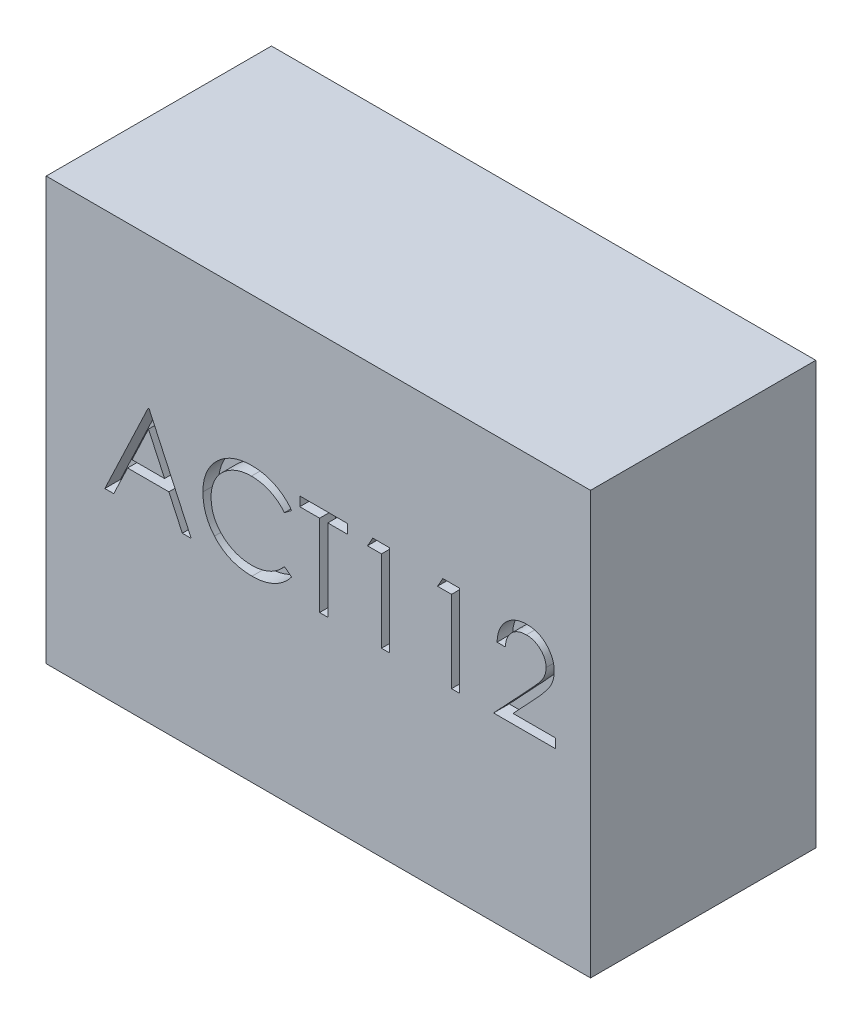
from build123d import *

# Parameters (mm, degrees)
SKETCH1_W           = 17.4
SKETCH1_H           = 7.2
BOSS_EXTRUDE1_DEPTH = 13.5
CUT_EXTRUDE1_DEPTH  = 0.5
CUT_EXTRUDE2_DEPTH  = 0.5


with BuildPart() as part:
    # Sketch1 → Boss-Extrude1 (new body)
    with BuildSketch(Plane(origin=(0, 0, 0), x_dir=(1, 0, 0), z_dir=(0, 1, 0))):
        Rectangle(SKETCH1_W, SKETCH1_H)
    extrude(amount=BOSS_EXTRUDE1_DEPTH)

    # Sketch3 → Cut-Extrude1 (cut)
    # profile 1 of 6: a face of its own
    with BuildSketch(Plane(origin=(0, 0, -3.6), x_dir=(-1, 0, 0), z_dir=(0, 0, -1))):
        Polygon((-6.182108672, 8.680727113), (-4.838839441, 5.770310446), (-5.122768311, 5.770310446), (-5.553034236, 6.703136301), (-6.872399805, 6.703136301), (-7.314909069, 5.770310446), (-7.600003971, 5.770310446), (-6.219421706, 8.680727113), align=None)
        Polygon((-6.20368027, 8.11345239), (-6.730726878, 7.001640575), (-5.69062605, 7.001640575), align=None, mode=Mode.SUBTRACT)
    # profile 2 of 6: a face of its own
    with BuildSketch(Plane(origin=(0, 0, -3.6), x_dir=(-1, 0, 0), z_dir=(0, 0, -1))):
        with BuildLine():
            Line((-1.629918501, 8.146684311), (-1.858460836, 7.971779464))
            add(Edge.make_bspline(
                [(-1.858460836, 7.971779464), (-1.874764065, 7.99120938), (-1.907150722, 8.029807256), (-1.959254833, 8.084007151), (-2.013556258, 8.134785824), (-2.070034242, 8.182385172), (-2.129705367, 8.225140662), (-2.191124138, 8.265280382), (-2.255317989, 8.301259567), (-2.34408714, 8.344885038), (-2.460210975, 8.390409073), (-2.606392755, 8.428579795), (-2.758990972, 8.452878595), (-2.863098738, 8.455510311), (-2.916052148, 8.456848908)],
                knots=[0, 0, 0, 0, 0.757959112, 1.505699292, 2.245454638, 2.979532153, 3.711538275, 4.438200793, 5.171680507, 5.909471876, 7.393775596, 8.890124382, 10.418191784, 12, 12, 12, 12], degree=3))
            add(Edge.make_bspline(
                [(-2.916052148, 8.456848908), (-2.945225582, 8.456512994), (-3.003301693, 8.455844283), (-3.089490335, 8.447022291), (-3.17406958, 8.434622909), (-3.256984413, 8.41622465), (-3.338129289, 8.392964085), (-3.418034698, 8.365169261), (-3.49554375, 8.330780743), (-3.571728678, 8.292772148), (-3.644721272, 8.249841469), (-3.713785499, 8.203014236), (-3.77866947, 8.152814457), (-3.839424511, 8.099053984), (-3.896112732, 8.041974925), (-3.948323371, 7.980968981), (-3.995875763, 7.916231192), (-4.03971248, 7.848615221), (-4.078972116, 7.778318022), (-4.111843093, 7.705079407), (-4.140951519, 7.630153554), (-4.163984758, 7.552693928), (-4.182216038, 7.473245569), (-4.19479541, 7.391595253), (-4.203517073, 7.307913556), (-4.204182459, 7.251194265), (-4.20451786, 7.222603699)],
                knots=[0, 0, 0, 0, 1.054917814, 2.100044995, 3.131103042, 4.146048494, 5.169673617, 6.183595914, 7.203665975, 8.234915748, 9.262203917, 10.264457458, 11.251630812, 12.227803204, 13.197192746, 14.159520551, 15.12972552, 16.100847026, 17.073214652, 18.039054194, 19.002613845, 19.979014051, 20.95965708, 21.949030935, 22.966165397, 24, 24, 24, 24], degree=3))
            add(Edge.make_bspline(
                [(-4.20451786, 7.222603699), (-4.203468598, 7.179586643), (-4.20140851, 7.09512836), (-4.18307427, 6.971418513), (-4.155213191, 6.852905786), (-4.113456548, 6.740331), (-4.061967908, 6.632306014), (-3.996907114, 6.530658587), (-3.921555148, 6.43385267), (-3.834846003, 6.344176123), (-3.739712119, 6.26225727), (-3.637641386, 6.19012003), (-3.528888023, 6.129986762), (-3.414652813, 6.079947597), (-3.294056693, 6.041482925), (-3.167316527, 6.014404306), (-3.034707969, 5.996740421), (-2.944094724, 5.995049313), (-2.897978647, 5.994188652)],
                knots=[0, 0, 0, 0, 1.029171465, 2.020641659, 2.987623507, 3.938342917, 4.889210282, 5.84687017, 6.821220943, 7.821438502, 8.827599549, 9.822697543, 10.807740252, 11.797342354, 12.80366471, 13.83203677, 14.896651826, 16, 16, 16, 16], degree=3))
            add(Edge.make_bspline(
                [(-2.897978647, 5.994188652), (-2.847168852, 5.995592952), (-2.747163019, 5.998356952), (-2.600504607, 6.021772709), (-2.460109628, 6.059739442), (-2.325970531, 6.112873607), (-2.198465471, 6.181946349), (-2.077394915, 6.265681429), (-1.962656668, 6.364875359), (-1.893662096, 6.440615317), (-1.858460836, 6.479258096)],
                knots=[0, 0, 0, 0, 1.028121516, 2.023589091, 2.998037872, 3.967518031, 4.937445131, 5.927275754, 6.942489185, 8, 8, 8, 8], degree=3))
            Line((-1.858460836, 6.479258096), (-1.629918501, 6.306102297))
            add(Edge.make_bspline(
                [(-1.629918501, 6.306102297), (-1.648310763, 6.282371215), (-1.685007188, 6.235022722), (-1.744427932, 6.168272973), (-1.807024589, 6.105487772), (-1.873262105, 6.047173316), (-1.942378507, 5.992162727), (-2.015614829, 5.942018883), (-2.092008304, 5.89604188), (-2.171300094, 5.853943181), (-2.253405952, 5.816592351), (-2.338227497, 5.784616212), (-2.425399113, 5.757071289), (-2.514924784, 5.734410006), (-2.606990208, 5.716722087), (-2.701263156, 5.70489775), (-2.797947093, 5.696796885), (-2.86317487, 5.69605854), (-2.896229599, 5.695684378)],
                knots=[0, 0, 0, 0, 0.986787822, 1.968848986, 2.935600012, 3.899624008, 4.868462664, 5.837806735, 6.815139263, 7.798259679, 8.787526145, 9.778297419, 10.776456485, 11.791383307, 12.812564526, 13.85620153, 14.913611965, 16, 16, 16, 16], degree=3))
            add(Edge.make_bspline(
                [(-2.896229599, 5.695684378), (-2.927532101, 5.695902237), (-2.989428922, 5.696333027), (-3.080814967, 5.703311514), (-3.169781898, 5.712832515), (-3.256075441, 5.727168505), (-3.340166505, 5.744085793), (-3.421292777, 5.766763141), (-3.500252556, 5.792166228), (-3.57672861, 5.822022934), (-3.650785992, 5.85571407), (-3.72218584, 5.893791931), (-3.790895316, 5.935936315), (-3.857589943, 5.981218249), (-3.921284481, 6.031092232), (-3.982530894, 6.084865618), (-4.04167262, 6.142357166), (-4.078262948, 6.183813851), (-4.096659871, 6.204657485)],
                knots=[0, 0, 0, 0, 1.114604814, 2.203992996, 3.262667896, 4.300477797, 5.318619304, 6.316056647, 7.298880507, 8.271930387, 9.238335007, 10.195173496, 11.151986948, 12.108099108, 13.064862484, 14.031167946, 15.010108607, 16, 16, 16, 16], degree=3))
            add(Edge.make_bspline(
                [(-4.096659871, 6.204657485), (-4.126126296, 6.240864057), (-4.184703401, 6.312840084), (-4.259647199, 6.429494557), (-4.323799065, 6.551289848), (-4.375667613, 6.678865824), (-4.416216148, 6.811936217), (-4.44430682, 6.950568106), (-4.462560624, 7.09463202), (-4.464648049, 7.192618921), (-4.465709099, 7.242426248)],
                knots=[0, 0, 0, 0, 0.994628077, 1.977248131, 2.950237994, 3.925870899, 4.908910175, 5.911660606, 6.938484602, 8, 8, 8, 8], degree=3))
            add(Edge.make_bspline(
                [(-4.465709099, 7.242426248), (-4.464415882, 7.294776706), (-4.461871557, 7.397772963), (-4.440254815, 7.548926661), (-4.405480495, 7.693741842), (-4.356089154, 7.83194817), (-4.293469168, 7.964272576), (-4.216113109, 8.08970422), (-4.124919658, 8.209045274), (-4.020604032, 8.320484921), (-3.906210242, 8.422382228), (-3.783707633, 8.51202822), (-3.653335978, 8.586632607), (-3.51653155, 8.648995487), (-3.372269945, 8.696929603), (-3.220858953, 8.730485199), (-3.062583081, 8.751371278), (-2.95459629, 8.754011614), (-2.899727696, 8.755353182)],
                knots=[0, 0, 0, 0, 1.032925535, 2.032216505, 3.007276963, 3.968222605, 4.92396291, 5.891752235, 6.871517503, 7.883894988, 8.900124299, 9.891468569, 10.874487609, 11.85992873, 12.854644235, 13.869047385, 14.917252991, 16, 16, 16, 16], degree=3))
            add(Edge.make_bspline(
                [(-2.899727696, 8.755353182), (-2.866287447, 8.754952261), (-2.800095843, 8.754158678), (-2.702178906, 8.746420178), (-2.606848352, 8.733519876), (-2.514038505, 8.715960858), (-2.423297854, 8.694168222), (-2.335319915, 8.665778938), (-2.249588448, 8.633318204), (-2.166644144, 8.595933098), (-2.086884965, 8.5539676), (-2.010335752, 8.50788687), (-1.937604557, 8.457748036), (-1.868179604, 8.403977527), (-1.803222255, 8.345437773), (-1.740888216, 8.283738938), (-1.683294331, 8.217103848), (-1.647743014, 8.170200459), (-1.629918501, 8.146684311)],
                knots=[0, 0, 0, 0, 1.096760587, 2.17092713, 3.219439832, 4.250915756, 5.268269357, 6.278326846, 7.281116186, 8.274029601, 9.260640565, 10.235837813, 11.203064059, 12.156899882, 13.114053108, 14.069676657, 15.032185724, 16, 16, 16, 16], degree=3))
        make_face()
    # profile 3 of 6: a face of its own
    with BuildSketch(Plane(origin=(0, 0, -3.6), x_dir=(-1, 0, 0), z_dir=(0, 0, -1))):
        Polygon((-1.368727262, 8.38222284), (-1.368727262, 8.680727113), (0.16110714, 8.680727113), (0.16110714, 8.38222284), (-0.473214441, 8.38222284), (-0.473214441, 5.770310446), (-0.734405681, 5.770310446), (-0.734405681, 8.38222284), align=None)
    # profile 4 of 6: a face of its own
    with BuildSketch(Plane(origin=(0, 0, -3.6), x_dir=(-1, 0, 0), z_dir=(0, 0, -1))):
        Polygon((0.966252456, 8.680727113), (1.504376371, 8.680727113), (1.504376371, 5.770310446), (1.243185131, 5.770310446), (1.243185131, 8.38222284), (0.795428721, 8.38222284), align=None)
    # profile 5 of 6: a face of its own
    with BuildSketch(Plane(origin=(0, 0, -3.6), x_dir=(-1, 0, 0), z_dir=(0, 0, -1))):
        Polygon((3.205034507, 8.680727113), (3.743158422, 8.680727113), (3.743158422, 5.770310446), (3.481967183, 5.770310446), (3.481967183, 8.38222284), (3.034210772, 8.38222284), align=None)
    # profile 6 of 6: a face of its own
    with BuildSketch(Plane(origin=(0, 0, -3.6), x_dir=(-1, 0, 0), z_dir=(0, 0, -1))):
        with BuildLine():
            Line((5.198366755, 7.785214293), (4.937175516, 7.785214293))
            add(Edge.make_bspline(
                [(4.937175516, 7.785214293), (4.938877821, 7.81986562), (4.942221103, 7.887919905), (4.957877722, 7.987143415), (4.980280345, 8.081985412), (5.011955203, 8.171684382), (5.051292625, 8.257033438), (5.098466344, 8.33769357), (5.154341231, 8.413357076), (5.217710759, 8.483322531), (5.286536824, 8.547507672), (5.360798965, 8.60293468), (5.438835574, 8.649765506), (5.520409896, 8.6889158), (5.606442281, 8.718302565), (5.696152015, 8.740107107), (5.789933237, 8.75322589), (5.853829374, 8.754636016), (5.886325823, 8.755353182)],
                knots=[0, 0, 0, 0, 1.10065271, 2.161652631, 3.183658789, 4.190468796, 5.17591951, 6.163126047, 7.15150782, 8.156236427, 9.156009102, 10.134482811, 11.092018607, 12.041330605, 13.001268258, 13.972401359, 14.968799086, 16, 16, 16, 16], degree=3))
            add(Edge.make_bspline(
                [(5.886325823, 8.755353182), (5.918239019, 8.754606072), (5.98094731, 8.753138029), (6.072469116, 8.740530911), (6.159596425, 8.720785321), (6.242158931, 8.693081966), (6.319497903, 8.655841582), (6.392194327, 8.611106367), (6.461113668, 8.559367614), (6.523152762, 8.49845358), (6.580120492, 8.433424573), (6.629266831, 8.364000406), (6.671354087, 8.292296649), (6.706435152, 8.217766531), (6.73225981, 8.139708301), (6.751866213, 8.059258395), (6.762948592, 7.975584073), (6.764649459, 7.918950229), (6.765514191, 7.890157201)],
                knots=[0, 0, 0, 0, 1.111607364, 2.184268762, 3.212621178, 4.221274766, 5.211760367, 6.196651075, 7.1921475, 8.207485113, 9.220403448, 10.201281604, 11.166441695, 12.114753415, 13.065576456, 14.026450734, 14.996634279, 16, 16, 16, 16], degree=3))
            add(Edge.make_bspline(
                [(6.765514191, 7.890157201), (6.764106162, 7.849621056), (6.761314814, 7.769260116), (6.737437442, 7.651167995), (6.700145433, 7.536752515), (6.655244059, 7.444669175), (6.609947628, 7.370467276), (6.569129028, 7.309374549), (6.521344301, 7.243594585), (6.465897955, 7.173347656), (6.403936954, 7.098083529), (6.334900072, 7.017847669), (6.258295009, 6.933469061), (6.204528387, 6.875838153), (6.17666787, 6.84597526)],
                knots=[0, 0, 0, 0, 1.184426356, 2.348067706, 3.509069118, 4.696110526, 5.333549288, 6.050745305, 6.844228056, 7.710549037, 8.667450064, 9.695053472, 10.805634456, 12, 12, 12, 12], degree=3))
            Line((6.17666787, 6.84597526), (5.448480688, 6.06881472))
            Line((5.448480688, 6.06881472), (6.802827225, 6.06881472))
            Line((6.802827225, 6.06881472), (6.802827225, 5.770310446))
            Line((6.802827225, 5.770310446), (4.825236413, 5.770310446))
            Line((4.825236413, 5.770310446), (5.953955698, 6.974821831))
            add(Edge.make_bspline(
                [(5.953955698, 6.974821831), (5.981436589, 7.003508816), (6.034221758, 7.058610643), (6.108880246, 7.139057021), (6.175935404, 7.213688038), (6.235821296, 7.282362685), (6.2872388, 7.346085483), (6.332867674, 7.402792627), (6.369427156, 7.45497594), (6.40910478, 7.515463225), (6.447533906, 7.589314896), (6.480556621, 7.679565826), (6.500692421, 7.772472357), (6.50310793, 7.835255896), (6.504322952, 7.866836555)],
                knots=[0, 0, 0, 0, 1.329631726, 2.553950428, 3.673215718, 4.687767853, 5.603093632, 6.413772471, 7.123043292, 7.734684054, 8.834405432, 9.900288307, 10.943827018, 12, 12, 12, 12], degree=3))
            add(Edge.make_bspline(
                [(6.504322952, 7.866836555), (6.503794302, 7.886695075), (6.502752434, 7.925832404), (6.493557432, 7.983213979), (6.479661851, 8.038565791), (6.459750228, 8.092058102), (6.433467719, 8.143153087), (6.401475271, 8.191912944), (6.36456282, 8.239052518), (6.321861794, 8.283252017), (6.274952929, 8.323732757), (6.225397473, 8.359592488), (6.172968309, 8.389560725), (6.117886493, 8.414127549), (6.060305588, 8.433398982), (6.000114225, 8.446752456), (5.937478719, 8.455136521), (5.894709318, 8.456270895), (5.872916451, 8.456848908)],
                knots=[0, 0, 0, 0, 0.991446411, 1.95395049, 2.89581595, 3.838931463, 4.798493298, 5.75982156, 6.748411868, 7.785213223, 8.824556874, 9.840280684, 10.836137867, 11.835679398, 12.848801643, 13.863922112, 14.911575587, 16, 16, 16, 16], degree=3))
            add(Edge.make_bspline(
                [(5.872916451, 8.456848908), (5.850156301, 8.456254325), (5.805459122, 8.455086661), (5.739834189, 8.446918648), (5.677230479, 8.432827375), (5.617490516, 8.413554867), (5.560513218, 8.38905868), (5.506575676, 8.358547748), (5.455798976, 8.322139688), (5.408087665, 8.280861202), (5.364128749, 8.234903559), (5.32550596, 8.183671941), (5.291758419, 8.128101763), (5.262313956, 8.068342967), (5.23840223, 8.003853306), (5.220130509, 7.934861709), (5.205672518, 7.861667739), (5.200842457, 7.811122046), (5.198366755, 7.785214293)],
                knots=[0, 0, 0, 0, 1.031018746, 2.02475058, 2.990194455, 3.934040569, 4.864654155, 5.795059489, 6.735614925, 7.690564532, 8.649604399, 9.611025574, 10.590972636, 11.591080095, 12.624614302, 13.701020113, 14.821632451, 16, 16, 16, 16], degree=3))
        make_face()
    extrude(amount=-CUT_EXTRUDE1_DEPTH, mode=Mode.SUBTRACT)

    # Sketch2 → Cut-Extrude2 (cut)
    # profile 1 of 6: a face of its own
    with BuildSketch(Plane.XY.offset(3.6)):
        Polygon((-5.407986461, 8.697285282), (-4.06471723, 5.786868616), (-4.3486461, 5.786868616), (-4.778912025, 6.71969447), (-6.098277594, 6.71969447), (-6.540786858, 5.786868616), (-6.82588176, 5.786868616), (-5.445299495, 8.697285282), align=None)
        Polygon((-5.429558059, 8.130010559), (-5.956604667, 7.018198744), (-4.916503839, 7.018198744), align=None, mode=Mode.SUBTRACT)
    # profile 2 of 6: a face of its own
    with BuildSketch(Plane.XY.offset(3.6)):
        with BuildLine():
            Line((-0.85579629, 8.16324248), (-1.084338624, 7.988337633))
            add(Edge.make_bspline(
                [(-1.084338624, 7.988337633), (-1.100641854, 8.007767549), (-1.133028511, 8.046365425), (-1.185132622, 8.10056532), (-1.239434047, 8.151343993), (-1.295912031, 8.198943341), (-1.355583156, 8.241698831), (-1.417001927, 8.281838551), (-1.481195778, 8.317817736), (-1.569964929, 8.361443207), (-1.686088764, 8.406967242), (-1.832270544, 8.445137964), (-1.984868761, 8.469436764), (-2.088976527, 8.47206848), (-2.141929937, 8.473407077)],
                knots=[0, 0, 0, 0, 0.757959112, 1.505699292, 2.245454638, 2.979532153, 3.711538275, 4.438200793, 5.171680507, 5.909471876, 7.393775596, 8.890124382, 10.418191784, 12, 12, 12, 12], degree=3))
            add(Edge.make_bspline(
                [(-2.141929937, 8.473407077), (-2.171103371, 8.473071163), (-2.229179482, 8.472402452), (-2.315368124, 8.46358046), (-2.399947369, 8.451181078), (-2.482862202, 8.432782819), (-2.564007078, 8.409522254), (-2.643912487, 8.38172743), (-2.721421539, 8.347338912), (-2.797606467, 8.309330317), (-2.870599061, 8.266399638), (-2.939663288, 8.219572405), (-3.004547259, 8.169372626), (-3.0653023, 8.115612153), (-3.121990521, 8.058533094), (-3.17420116, 7.99752715), (-3.221753552, 7.932789361), (-3.265590269, 7.86517339), (-3.304849905, 7.794876191), (-3.337720882, 7.721637576), (-3.366829308, 7.646711724), (-3.389862547, 7.569252098), (-3.408093827, 7.489803738), (-3.420673199, 7.408153422), (-3.429394862, 7.324471725), (-3.430060247, 7.267752434), (-3.430395649, 7.239161868)],
                knots=[0, 0, 0, 0, 1.054917814, 2.100044995, 3.131103042, 4.146048494, 5.169673617, 6.183595914, 7.203665975, 8.234915748, 9.262203917, 10.264457458, 11.251630812, 12.227803204, 13.197192746, 14.159520551, 15.12972552, 16.100847026, 17.073214652, 18.039054194, 19.002613845, 19.979014051, 20.95965708, 21.949030935, 22.966165397, 24, 24, 24, 24], degree=3))
            add(Edge.make_bspline(
                [(-3.430395649, 7.239161868), (-3.429346386, 7.196144812), (-3.427286299, 7.111686529), (-3.408952059, 6.987976682), (-3.38109098, 6.869463955), (-3.339334336, 6.756889169), (-3.287845697, 6.648864184), (-3.222784903, 6.547216756), (-3.147432937, 6.450410839), (-3.060723792, 6.360734293), (-2.965589908, 6.278815439), (-2.863519175, 6.206678199), (-2.754765811, 6.146544931), (-2.640530602, 6.096505766), (-2.519934482, 6.058041094), (-2.393194316, 6.030962475), (-2.260585758, 6.01329859), (-2.169972513, 6.011607482), (-2.123856436, 6.010746821)],
                knots=[0, 0, 0, 0, 1.029171465, 2.020641659, 2.987623507, 3.938342917, 4.889210282, 5.84687017, 6.821220943, 7.821438502, 8.827599549, 9.822697543, 10.807740252, 11.797342354, 12.80366471, 13.83203677, 14.896651826, 16, 16, 16, 16], degree=3))
            add(Edge.make_bspline(
                [(-2.123856436, 6.010746821), (-2.073046641, 6.012151121), (-1.973040808, 6.014915121), (-1.826382396, 6.038330878), (-1.685987417, 6.076297611), (-1.55184832, 6.129431776), (-1.42434326, 6.198504518), (-1.303272704, 6.282239598), (-1.188534457, 6.381433528), (-1.119539885, 6.457173486), (-1.084338624, 6.495816265)],
                knots=[0, 0, 0, 0, 1.028121516, 2.023589091, 2.998037872, 3.967518031, 4.937445131, 5.927275754, 6.942489185, 8, 8, 8, 8], degree=3))
            Line((-1.084338624, 6.495816265), (-0.85579629, 6.322660466))
            add(Edge.make_bspline(
                [(-0.85579629, 6.322660466), (-0.874188552, 6.298929384), (-0.910884977, 6.251580891), (-0.970305721, 6.184831142), (-1.032902378, 6.122045941), (-1.099139894, 6.063731485), (-1.168256296, 6.008720896), (-1.241492618, 5.958577052), (-1.317886093, 5.912600049), (-1.397177883, 5.87050135), (-1.479283741, 5.833150521), (-1.564105286, 5.801174381), (-1.651276902, 5.773629458), (-1.740802573, 5.750968175), (-1.832867997, 5.733280256), (-1.927140944, 5.721455919), (-2.023824882, 5.713355054), (-2.089052659, 5.712616709), (-2.122107388, 5.712242547)],
                knots=[0, 0, 0, 0, 0.986787822, 1.968848986, 2.935600012, 3.899624008, 4.868462664, 5.837806735, 6.815139263, 7.798259679, 8.787526145, 9.778297419, 10.776456485, 11.791383307, 12.812564526, 13.85620153, 14.913611965, 16, 16, 16, 16], degree=3))
            add(Edge.make_bspline(
                [(-2.122107388, 5.712242547), (-2.15340989, 5.712460406), (-2.21530671, 5.712891196), (-2.306692756, 5.719869683), (-2.395659687, 5.729390685), (-2.48195323, 5.743726674), (-2.566044294, 5.760643962), (-2.647170565, 5.78332131), (-2.726130345, 5.808724397), (-2.802606399, 5.838581103), (-2.876663781, 5.872272239), (-2.948063628, 5.9103501), (-3.016773105, 5.952494484), (-3.083467731, 5.997776419), (-3.14716227, 6.047650401), (-3.208408683, 6.101423787), (-3.267550409, 6.158915335), (-3.304140737, 6.20037202), (-3.32253766, 6.221215654)],
                knots=[0, 0, 0, 0, 1.114604814, 2.203992996, 3.262667896, 4.300477797, 5.318619304, 6.316056647, 7.298880507, 8.271930387, 9.238335007, 10.195173496, 11.151986948, 12.108099108, 13.064862484, 14.031167946, 15.010108607, 16, 16, 16, 16], degree=3))
            add(Edge.make_bspline(
                [(-3.32253766, 6.221215654), (-3.352004085, 6.257422226), (-3.41058119, 6.329398253), (-3.485524988, 6.446052726), (-3.549676853, 6.567848017), (-3.601545402, 6.695423993), (-3.642093937, 6.828494386), (-3.670184609, 6.967126275), (-3.688438413, 7.111190189), (-3.690525838, 7.20917709), (-3.691586888, 7.258984417)],
                knots=[0, 0, 0, 0, 0.994628077, 1.977248131, 2.950237994, 3.925870899, 4.908910175, 5.911660606, 6.938484602, 8, 8, 8, 8], degree=3))
            add(Edge.make_bspline(
                [(-3.691586888, 7.258984417), (-3.690293671, 7.311334875), (-3.687749346, 7.414331132), (-3.666132604, 7.56548483), (-3.631358284, 7.710300011), (-3.581966943, 7.848506339), (-3.519346957, 7.980830745), (-3.441990898, 8.10626239), (-3.350797447, 8.225603443), (-3.246481821, 8.33704309), (-3.13208803, 8.438940397), (-3.009585422, 8.528586389), (-2.879213767, 8.603190776), (-2.742409339, 8.665553656), (-2.598147734, 8.713487772), (-2.446736741, 8.747043368), (-2.28846087, 8.767929447), (-2.180474079, 8.770569783), (-2.125605485, 8.771911351)],
                knots=[0, 0, 0, 0, 1.032925535, 2.032216505, 3.007276963, 3.968222605, 4.92396291, 5.891752235, 6.871517503, 7.883894988, 8.900124299, 9.891468569, 10.874487609, 11.85992873, 12.854644235, 13.869047385, 14.917252991, 16, 16, 16, 16], degree=3))
            add(Edge.make_bspline(
                [(-2.125605485, 8.771911351), (-2.092165236, 8.77151043), (-2.025973632, 8.770716847), (-1.928056695, 8.762978347), (-1.832726141, 8.750078045), (-1.739916294, 8.732519027), (-1.649175643, 8.710726391), (-1.561197704, 8.682337107), (-1.475466237, 8.649876373), (-1.392521933, 8.612491267), (-1.312762754, 8.570525769), (-1.236213541, 8.524445039), (-1.163482346, 8.474306206), (-1.094057393, 8.420535696), (-1.029100044, 8.361995942), (-0.966766005, 8.300297107), (-0.90917212, 8.233662017), (-0.873620803, 8.186758628), (-0.85579629, 8.16324248)],
                knots=[0, 0, 0, 0, 1.096760587, 2.17092713, 3.219439832, 4.250915756, 5.268269357, 6.278326846, 7.281116186, 8.274029601, 9.260640565, 10.235837813, 11.203064059, 12.156899882, 13.114053108, 14.069676657, 15.032185724, 16, 16, 16, 16], degree=3))
        make_face()
    # profile 3 of 6: a face of its own
    with BuildSketch(Plane.XY.offset(3.6)):
        Polygon((-0.594605051, 8.398781009), (-0.594605051, 8.697285282), (0.935229351, 8.697285282), (0.935229351, 8.398781009), (0.30090777, 8.398781009), (0.30090777, 5.786868616), (0.03971653, 5.786868616), (0.03971653, 8.398781009), align=None)
    # profile 4 of 6: a face of its own
    with BuildSketch(Plane.XY.offset(3.6)):
        Polygon((1.740374667, 8.697285282), (2.278498582, 8.697285282), (2.278498582, 5.786868616), (2.017307342, 5.786868616), (2.017307342, 8.398781009), (1.569550932, 8.398781009), align=None)
    # profile 5 of 6: a face of its own
    with BuildSketch(Plane.XY.offset(3.6)):
        Polygon((3.979156718, 8.697285282), (4.517280633, 8.697285282), (4.517280633, 5.786868616), (4.256089394, 5.786868616), (4.256089394, 8.398781009), (3.808332983, 8.398781009), align=None)
    # profile 6 of 6: a face of its own
    with BuildSketch(Plane.XY.offset(3.6)):
        with BuildLine():
            Line((5.972488966, 7.801772462), (5.711297727, 7.801772462))
            add(Edge.make_bspline(
                [(5.711297727, 7.801772462), (5.713000032, 7.836423789), (5.716343314, 7.904478074), (5.731999933, 8.003701584), (5.754402556, 8.098543581), (5.786077414, 8.188242551), (5.825414836, 8.273591607), (5.872588555, 8.354251739), (5.928463442, 8.429915245), (5.99183297, 8.4998807), (6.060659035, 8.564065841), (6.134921176, 8.619492849), (6.212957785, 8.666323675), (6.294532107, 8.705473969), (6.380564492, 8.734860734), (6.470274226, 8.756665276), (6.564055448, 8.769784059), (6.627951585, 8.771194185), (6.660448034, 8.771911351)],
                knots=[0, 0, 0, 0, 1.10065271, 2.161652631, 3.183658789, 4.190468796, 5.17591951, 6.163126047, 7.15150782, 8.156236427, 9.156009102, 10.134482811, 11.092018607, 12.041330605, 13.001268258, 13.972401359, 14.968799086, 16, 16, 16, 16], degree=3))
            add(Edge.make_bspline(
                [(6.660448034, 8.771911351), (6.69236123, 8.771164241), (6.755069521, 8.769696198), (6.846591327, 8.75708908), (6.933718637, 8.73734349), (7.016281142, 8.709640135), (7.093620114, 8.672399751), (7.166316538, 8.627664536), (7.235235879, 8.575925783), (7.297274973, 8.515011749), (7.354242703, 8.449982742), (7.403389042, 8.380558575), (7.445476298, 8.308854818), (7.480557363, 8.2343247), (7.506382021, 8.15626647), (7.525988424, 8.075816564), (7.537070803, 7.992142242), (7.53877167, 7.935508398), (7.539636402, 7.90671537)],
                knots=[0, 0, 0, 0, 1.111607364, 2.184268762, 3.212621178, 4.221274766, 5.211760367, 6.196651075, 7.1921475, 8.207485113, 9.220403448, 10.201281604, 11.166441695, 12.114753415, 13.065576456, 14.026450734, 14.996634279, 16, 16, 16, 16], degree=3))
            add(Edge.make_bspline(
                [(7.539636402, 7.90671537), (7.538228374, 7.866179225), (7.535437025, 7.785818285), (7.511559654, 7.667726164), (7.474267644, 7.553310684), (7.429366271, 7.461227344), (7.384069839, 7.387025445), (7.343251239, 7.325932718), (7.295466513, 7.260152754), (7.240020166, 7.189905826), (7.178059165, 7.114641698), (7.109022283, 7.034405838), (7.03241722, 6.95002723), (6.978650598, 6.892396322), (6.950790081, 6.862533429)],
                knots=[0, 0, 0, 0, 1.184426356, 2.348067706, 3.509069118, 4.696110526, 5.333549288, 6.050745305, 6.844228056, 7.710549037, 8.667450064, 9.695053472, 10.805634456, 12, 12, 12, 12], degree=3))
            Line((6.950790081, 6.862533429), (6.222602899, 6.085372889))
            Line((6.222602899, 6.085372889), (7.576949436, 6.085372889))
            Line((7.576949436, 6.085372889), (7.576949436, 5.786868616))
            Line((7.576949436, 5.786868616), (5.599358624, 5.786868616))
            Line((5.599358624, 5.786868616), (6.728077909, 6.99138))
            add(Edge.make_bspline(
                [(6.728077909, 6.99138), (6.7555588, 7.020066985), (6.808343969, 7.075168812), (6.883002457, 7.15561519), (6.950057616, 7.230246207), (7.009943507, 7.298920854), (7.061361011, 7.362643652), (7.106989885, 7.419350796), (7.143549368, 7.471534109), (7.183226991, 7.532021394), (7.221656117, 7.605873065), (7.254678833, 7.696123995), (7.274814632, 7.789030526), (7.277230141, 7.851814066), (7.278445163, 7.883394724)],
                knots=[0, 0, 0, 0, 1.329631726, 2.553950428, 3.673215718, 4.687767853, 5.603093632, 6.413772471, 7.123043292, 7.734684054, 8.834405432, 9.900288307, 10.943827018, 12, 12, 12, 12], degree=3))
            add(Edge.make_bspline(
                [(7.278445163, 7.883394724), (7.277916513, 7.903253244), (7.276874645, 7.942390573), (7.267679643, 7.999772148), (7.253784062, 8.055123961), (7.233872439, 8.108616271), (7.20758993, 8.159711256), (7.175597482, 8.208471113), (7.138685031, 8.255610687), (7.095984005, 8.299810186), (7.04907514, 8.340290926), (6.999519684, 8.376150657), (6.94709052, 8.406118894), (6.892008704, 8.430685718), (6.834427799, 8.449957151), (6.774236436, 8.463310625), (6.71160093, 8.47169469), (6.668831529, 8.472829064), (6.647038662, 8.473407077)],
                knots=[0, 0, 0, 0, 0.991446411, 1.95395049, 2.89581595, 3.838931463, 4.798493298, 5.75982156, 6.748411868, 7.785213223, 8.824556874, 9.840280684, 10.836137867, 11.835679398, 12.848801643, 13.863922112, 14.911575587, 16, 16, 16, 16], degree=3))
            add(Edge.make_bspline(
                [(6.647038662, 8.473407077), (6.624278512, 8.472812494), (6.579581334, 8.47164483), (6.5139564, 8.463476817), (6.451352691, 8.449385544), (6.391612727, 8.430113036), (6.334635429, 8.405616849), (6.280697887, 8.375105917), (6.229921187, 8.338697857), (6.182209876, 8.297419371), (6.13825096, 8.251461728), (6.099628171, 8.20023011), (6.065880631, 8.144659932), (6.036436167, 8.084901136), (6.012524441, 8.020411475), (5.99425272, 7.951419878), (5.979794729, 7.878225908), (5.974964668, 7.827680215), (5.972488966, 7.801772462)],
                knots=[0, 0, 0, 0, 1.031018746, 2.02475058, 2.990194455, 3.934040569, 4.864654155, 5.795059489, 6.735614925, 7.690564532, 8.649604399, 9.611025574, 10.590972636, 11.591080095, 12.624614302, 13.701020113, 14.821632451, 16, 16, 16, 16], degree=3))
        make_face()
    extrude(amount=-CUT_EXTRUDE2_DEPTH, mode=Mode.SUBTRACT)


solid = part.part
